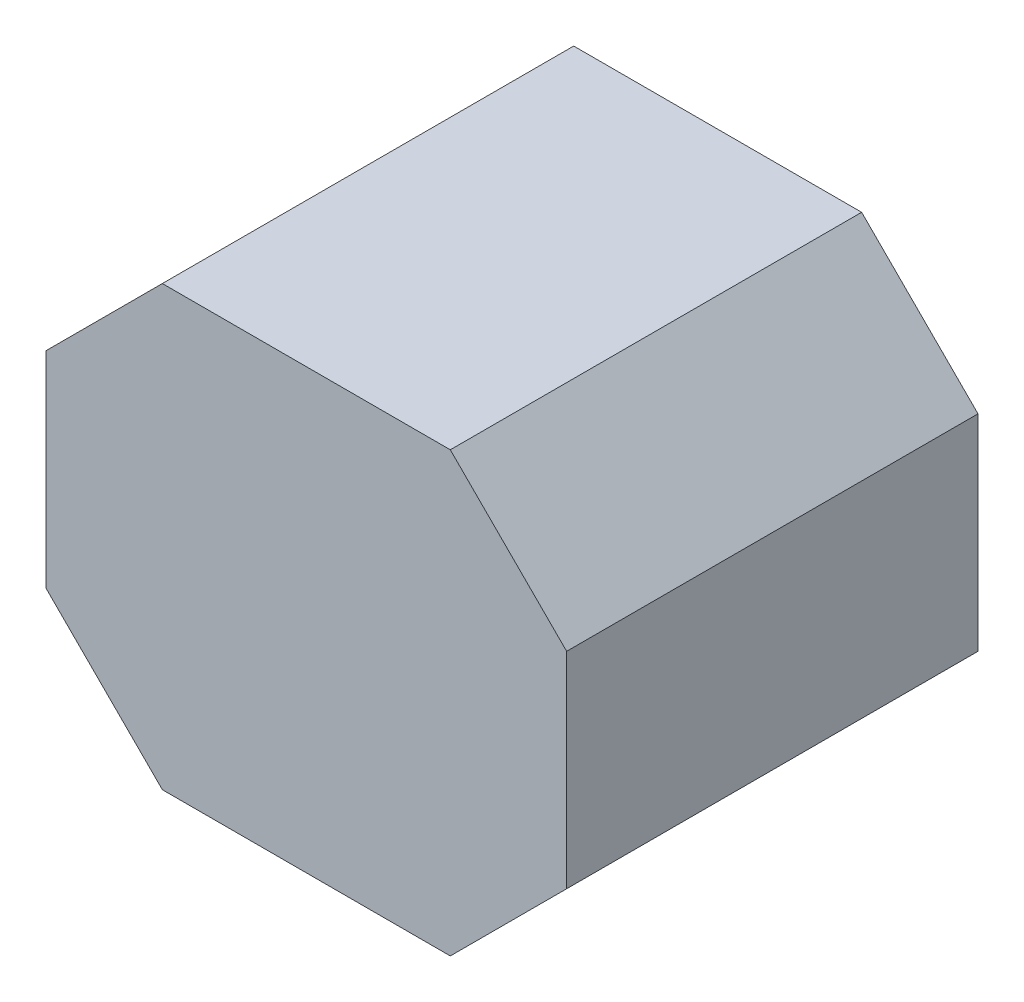
from build123d import *

# Parameters (mm, degrees)
BOSS_EXTRUDE1_DEPTH = 127


with BuildPart() as part:
    # Sketch1 → Boss-Extrude1 (new, symmetric)
    with BuildSketch(Plane.XY):
        Polygon((-88.9, 0), (88.9, 0), (160.742048969, 71.842048969), (160.742048969, 198.842048969), (88.9, 270.684097937), (-88.9, 270.684097937), (-160.742048969, 198.842048969), (-160.742048969, 71.842048969), align=None)
    extrude(amount=BOSS_EXTRUDE1_DEPTH, both=True)


solid = part.part
